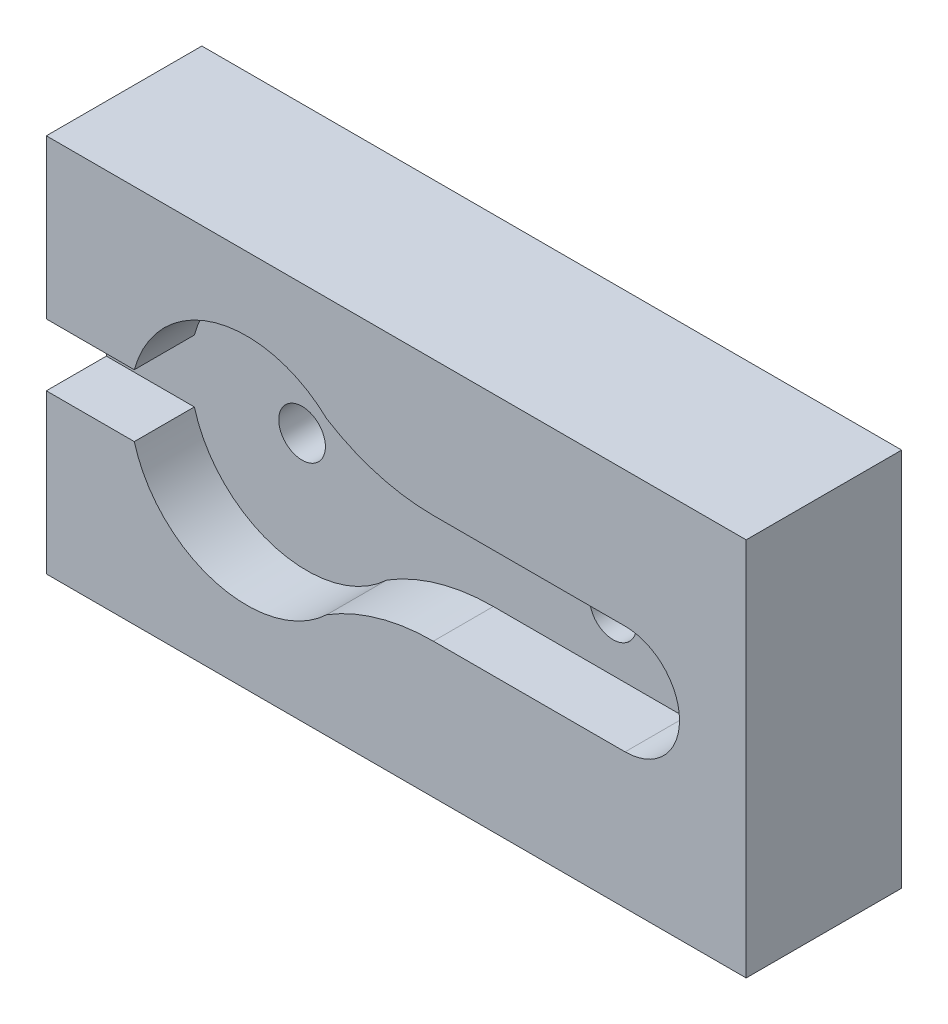
from build123d import *

# Parameters (mm, degrees)
SKETCH2_W           = 24.4
SKETCH2_H           = 45
BOSS_EXTRUDE1_DEPTH = 10
CUT_EXTRUDE1_DEPTH  = 3.86
SKETCH4_R           = 1.5
CUT_EXTRUDE2_DEPTH  = 27.320896641
CUT_EXTRUDE4_DEPTH  = 3.86


with BuildPart() as part:
    # Sketch2 → Boss-Extrude1 (new body)
    with BuildSketch(Plane(origin=(0, 0, 0), x_dir=(0, 1, 0), z_dir=(0, 0, 1))):
        Rectangle(SKETCH2_W, SKETCH2_H)
    extrude(amount=BOSS_EXTRUDE1_DEPTH)

    # Sketch3 → Cut-Extrude1 (cut)
    with BuildSketch(Plane.XY.offset(10)):
        with BuildLine():
            Line((14.715504893, 3.5), (2.384966333, 3.5))
            ThreePointArc((2.384966333, 3.5), (-1.174243063, 3.996719292), (-4.461463541, 5.448918697))
            ThreePointArc((-4.461463541, 5.448918697), (-17.115033667, 0), (-4.461463541, -5.448918697))
            ThreePointArc((-4.461463541, -5.448918697), (-1.174243063, -3.996719292), (2.384966333, -3.5))
            Line((2.384966333, -3.5), (14.715504893, -3.5))
            ThreePointArc((14.715504893, -3.5), (18.215504893, 0), (14.715504893, 3.5))
        make_face()
    extrude(amount=-CUT_EXTRUDE1_DEPTH, mode=Mode.SUBTRACT)

    # Sketch4 → Cut-Extrude2 (cut, through all)
    with BuildSketch(Plane.XY.offset(6.14)):
        with Locations((10.084966333, 0)):
            Circle(SKETCH4_R)
        with Locations((14.084966333, 0)):
            Circle(SKETCH4_R)
        with Locations((-9.915033667, 0)):
            Circle(SKETCH4_R)
    extrude(amount=-CUT_EXTRUDE2_DEPTH, mode=Mode.SUBTRACT)

    # Sketch6 → Cut-Extrude4 (cut)
    with BuildSketch(Plane.XY.offset(10)):
        with BuildLine():
            Line((-22.5, 2), (-16.843449814, 2))
            ThreePointArc((-16.843449814, 2), (-17.115033667, 0), (-16.843449814, -2))
            Line((-16.843449814, -2), (-22.5, -2))
            Line((-22.5, -2), (-22.5, 2))
        make_face()
    extrude(amount=-CUT_EXTRUDE4_DEPTH, mode=Mode.SUBTRACT)


solid = part.part
